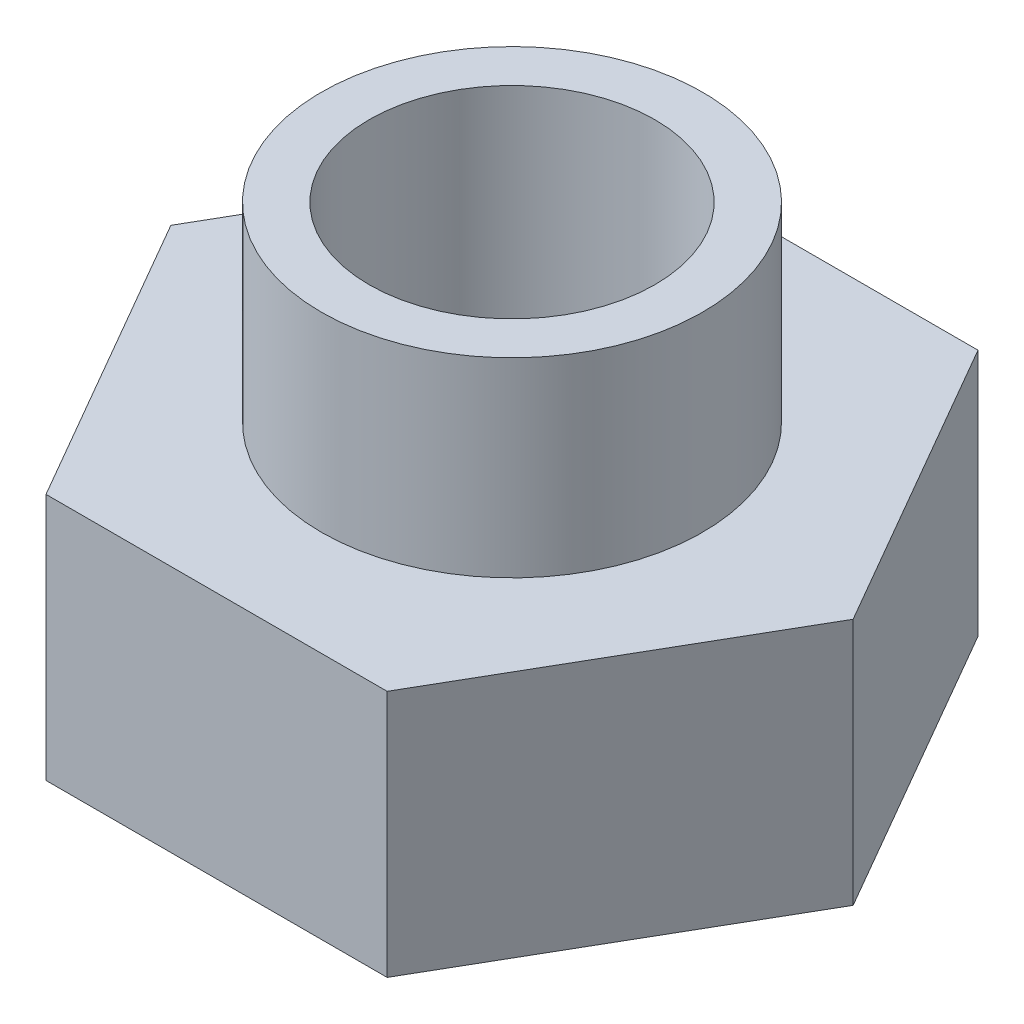
from build123d import *

# Parameters (mm, degrees)
SKETCH1_R           = 50
BOSS_EXTRUDE1_DEPTH = 65
SKETCH1_3_R         = 50
BOSS_EXTRUDE2_DEPTH = 115
SKETCH1_4_R         = 37.5
CUT_EXTRUDE1_DEPTH  = 115


with BuildPart() as part:
    # Sketch1 → Boss-Extrude1 (new body)
    with BuildSketch(Plane(origin=(0, 0, 0), x_dir=(1, 0, 0), z_dir=(0, 1, 0))):
        Polygon((44.744645862, -77.5), (89.489291724, 0), (44.744645862, 77.5), (-44.744645862, 77.5), (-89.489291724, 0), (-44.744645862, -77.5), align=None)
        Circle(SKETCH1_R, mode=Mode.SUBTRACT)
    extrude(amount=BOSS_EXTRUDE1_DEPTH)

    # Sketch1<3> → Boss-Extrude2 (add)
    with BuildSketch(Plane(origin=(0, 0, 0), x_dir=(1, 0, 0), z_dir=(0, 1, 0))):
        Circle(SKETCH1_3_R)
    extrude(amount=BOSS_EXTRUDE2_DEPTH)

    # Sketch1<4> → Cut-Extrude1 (cut)
    with BuildSketch(Plane(origin=(0, 0, 0), x_dir=(1, 0, 0), z_dir=(0, 1, 0))):
        Circle(SKETCH1_4_R)
    extrude(amount=CUT_EXTRUDE1_DEPTH, mode=Mode.SUBTRACT)


solid = part.part
